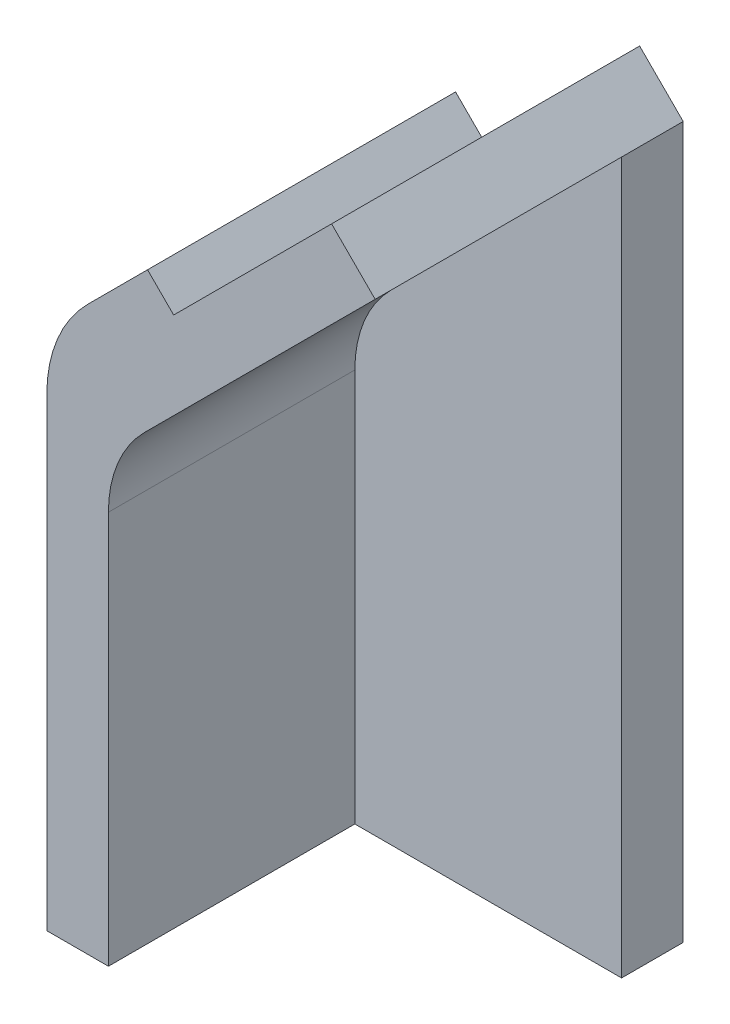
from build123d import *

# Parameters (mm, degrees)
BOSS_EXTRUDE1_DEPTH = 5
BOSS_EXTRUDE2_START = -2
BOSS_EXTRUDE2_DEPTH = 2


with BuildPart() as part:
    # Sketch2 → Boss-Extrude1 (new, symmetric)
    with BuildSketch(Plane(origin=(-44.395698949, 24.726348819, -28.895), x_dir=(0.707106781186551, -0.7071067811865441, 0), z_dir=(0, 0, 1))):
        with BuildLine():
            Line((5.05, 7), (7.05, 7))
            Line((7.05, 7), (7.05, -3.589034995))
            ThreePointArc((7.05, -3.589034995), (7.35448187, -5.119768725), (8.221572875, -6.41746212))
            Line((8.221572875, -6.41746212), (17.247782384, -15.443671629))
            Line((17.247782384, -15.443671629), (15.833568821, -16.857885191))
            Line((15.833568821, -16.857885191), (5.175341815, -6.199658185))
            ThreePointArc((5.175341815, -6.199658185), (4.194445115, -4.731642531), (3.85, -3))
            Line((3.85, -3), (3.85, -0.25))
            Line((3.85, -0.25), (5.05, -0.25))
            Line((5.05, -0.25), (5.05, 7))
        make_face()
    extrude(amount=BOSS_EXTRUDE1_DEPTH, both=True)

    # Sketch3 → Boss-Extrude2 (add)
    with BuildSketch(Plane(origin=(0, 0, -33.895), x_dir=(-1, 0, 0), z_dir=(0, 0, -1)).offset(BOSS_EXTRUDE2_START)):
        with BuildLine():
            Line((34.460848673, 24.69099348), (34.460848673, 1.61))
            Line((34.460848673, 1.61), (43.12, 1.61))
            Line((43.12, 1.61), (43.12, 14.374987904))
            ThreePointArc((43.12, 14.374987904), (42.81551813, 15.905721633), (41.948427125, 17.203415028))
            Line((41.948427125, 17.203415028), (34.460848673, 24.69099348))
        make_face()
    extrude(amount=BOSS_EXTRUDE2_DEPTH)


solid = part.part
